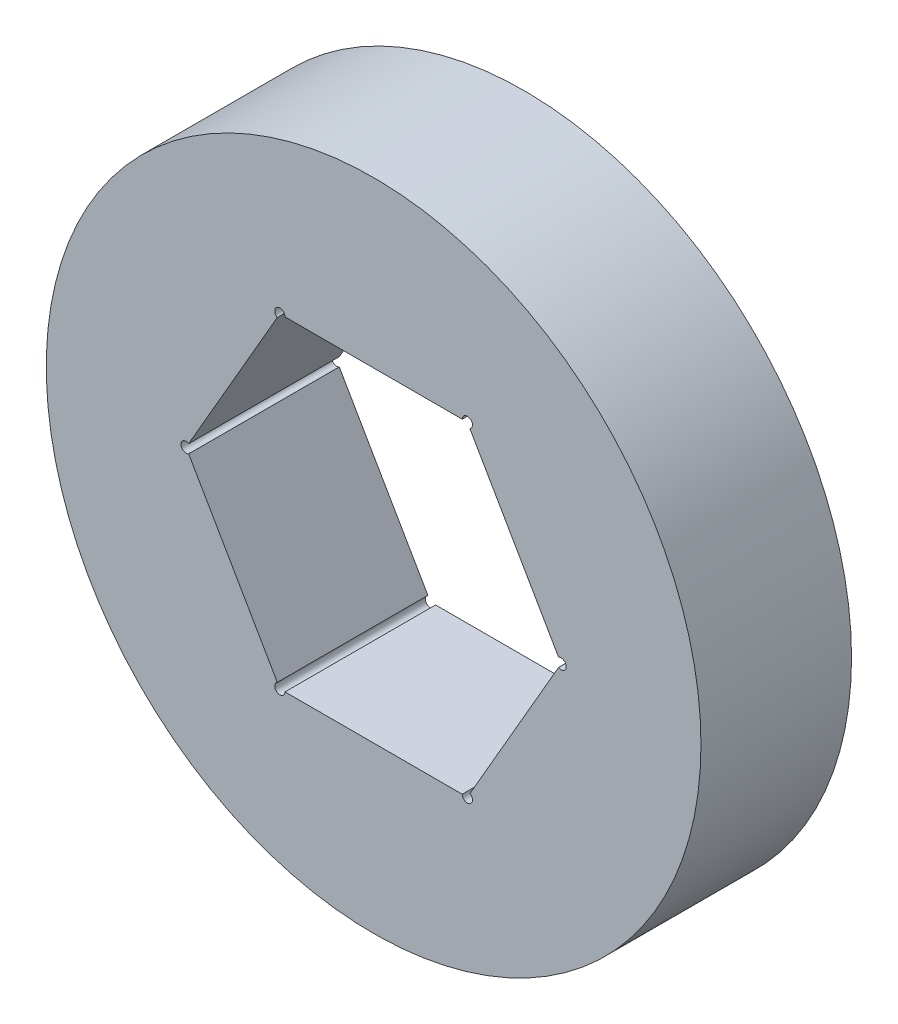
from build123d import *

# Parameters (mm, degrees)
SKETCH1_R           = 12.7
BOSS_EXTRUDE1_DEPTH = 5.842
SKETCH2_R           = 0.1984375
CUT_EXTRUDE1_DEPTH  = 19.886740428


with BuildPart() as part:
    # Sketch1 → Boss-Extrude1 (new body)
    with BuildSketch(Plane.XY):
        Circle(SKETCH1_R)
        Polygon((-7.274613392, 0), (-3.637306696, -6.3), (3.637306696, -6.3), (7.274613392, 0), (3.637306696, 6.3), (-3.637306696, 6.3), align=None, mode=Mode.SUBTRACT)
    extrude(amount=BOSS_EXTRUDE1_DEPTH)

    # Sketch2 → Cut-Extrude1 (cut, through all)
    with BuildSketch(Plane.XY.offset(5.842)):
        with Locations((3.637306696, 6.3)):
            Circle(SKETCH2_R)
        with Locations((-3.637306696, 6.3)):
            Circle(SKETCH2_R)
        with Locations((-7.274613392, 0)):
            Circle(SKETCH2_R)
        with Locations((-3.637306696, -6.3)):
            Circle(SKETCH2_R)
        with Locations((3.637306696, -6.3)):
            Circle(SKETCH2_R)
        with Locations((7.274613392, 0)):
            Circle(SKETCH2_R)
    extrude(amount=-CUT_EXTRUDE1_DEPTH, mode=Mode.SUBTRACT)


solid = part.part
